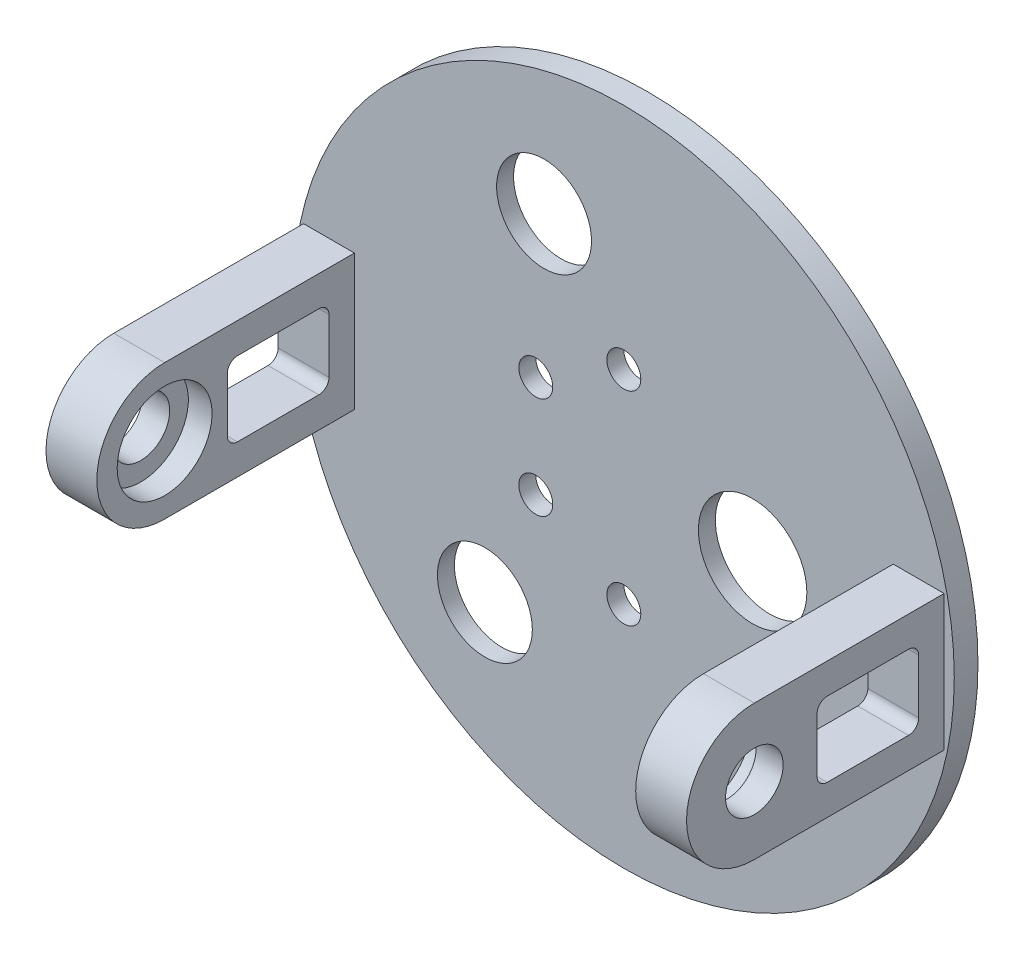
from build123d import *

# Parameters (mm, degrees)
SKETCH1_R           = 97.5
SKETCH1_R_2         = 16
BOSS_EXTRUDE1_DEPTH = 2.5
SKETCH2_R           = 5
CUT_EXTRUDE1_DEPTH  = 138.976447265
CIRPATTERN1_COUNT   = 4
CIRPATTERN1_ANGLE   = 180
SKETCH4_R           = 97.5
SKETCH4_R_2         = 94.5
BOSS_EXTRUDE2_DEPTH = 2
SKETCH5_R           = 8.5
BOSS_EXTRUDE3_DEPTH = 7.5
SKETCH6_R           = 14
CUT_EXTRUDE2_DEPTH  = 7
CUT_EXTRUDE3_REACH  = 231.2
CUT_EXTRUDE4_REACH  = 159.444
SKETCH8_R           = 14
SKETCH9_R           = 14
CUT_EXTRUDE5_DEPTH  = 158.44364071


with BuildPart() as part:
    # Sketch1 → Boss-Extrude1 (new, symmetric)
    with BuildSketch(Plane.XY):
        Circle(SKETCH1_R)
        with Locations((38, 0)):
            Circle(SKETCH1_R_2, mode=Mode.SUBTRACT)
    extrude(amount=BOSS_EXTRUDE1_DEPTH, both=True)

    # Sketch2 → Cut-Extrude1 (cut, through all)
    with BuildSketch(Plane.XY.offset(2.5)):
        with Locations((0, 30)):
            Circle(SKETCH2_R)
    cut_extrude1 = extrude(amount=-CUT_EXTRUDE1_DEPTH, mode=Mode.SUBTRACT)

    # CirPattern1: Cut-Extrude1 ×4 about axis
    cirpattern1_axis = Axis((0, 0, 2.5), (0, 0, 1))
    for i in range(1, CIRPATTERN1_COUNT):
        add(cut_extrude1.rotate(cirpattern1_axis, i * CIRPATTERN1_ANGLE / (CIRPATTERN1_COUNT - 1)), mode=Mode.SUBTRACT)

    # Sketch4 → Boss-Extrude2 (add)
    with BuildSketch(Plane(origin=(0, 0, -2.5), x_dir=(-1, 0, 0), z_dir=(0, 0, -1))):
        Circle(SKETCH4_R)
        Circle(SKETCH4_R_2, mode=Mode.SUBTRACT)
    extrude(amount=BOSS_EXTRUDE2_DEPTH)

    # Sketch5 → Boss-Extrude3 (add, symmetric)
    with BuildSketch(Plane(origin=(87, 0, 0), x_dir=(0, 0, -1), z_dir=(1, 0, 0))):
        with BuildLine():
            Line((-2.5, 20), (-58.5, 20))
            ThreePointArc((-58.5, 20), (-78.5, 0), (-58.5, -20))
            Line((-58.5, -20), (-2.5, -20))
            Line((-2.5, -20), (-2.5, 20))
        make_face()
        with Locations((-58.5, 0)):
            Circle(SKETCH5_R, mode=Mode.SUBTRACT)
    boss_extrude3 = extrude(amount=BOSS_EXTRUDE3_DEPTH, both=True)

    # Sketch6 → Cut-Extrude2 (cut)
    with BuildSketch(Plane.ZY.offset(-79.5)):
        with Locations((58.5, 0)):
            Circle(SKETCH6_R)
    cut_extrude2 = extrude(amount=-CUT_EXTRUDE2_DEPTH, mode=Mode.SUBTRACT)

    # Sketch7 → Cut-Extrude3 (cut, up to next)
    with BuildSketch(Plane(origin=(94.5, 0, 0), x_dir=(0, 0, -1), z_dir=(1, 0, 0)), mode=Mode.PRIVATE) as cut_extrude3_sk1:
        with BuildLine():
            Line((-13, 11), (-37, 11))
            ThreePointArc((-37, 11), (-39.121320344, 10.121320344), (-40, 8))
            Line((-40, 8), (-40, -8))
            ThreePointArc((-40, -8), (-39.121320344, -10.121320344), (-37, -11))
            Line((-37, -11), (-13, -11))
            ThreePointArc((-13, -11), (-10.878679656, -10.121320344), (-10, -8))
            Line((-10, -8), (-10, 8))
            ThreePointArc((-10, 8), (-10.878679656, 10.121320344), (-13, 11))
        make_face()
    cut_extrude3_tool1 = extrude(cut_extrude3_sk1.sketch, amount=-CUT_EXTRUDE3_REACH, mode=Mode.PRIVATE) & part.part
    cut_extrude3 = cut_extrude3_tool1.solids().sort_by_distance((94.5, 0, 25))[0]
    add(cut_extrude3, mode=Mode.SUBTRACT)

    # Mirror1: Boss-Extrude3, Cut-Extrude2, Cut-Extrude3 across plane
    add(boss_extrude3.mirror(Plane(origin=(0, 0, 0), x_dir=(0, 0, 1), z_dir=(1, 0, 0))))
    add(cut_extrude2.mirror(Plane(origin=(0, 0, 0), x_dir=(0, 0, 1), z_dir=(1, 0, 0))), mode=Mode.SUBTRACT)
    add(cut_extrude3.mirror(Plane(origin=(0, 0, 0), x_dir=(0, 0, 1), z_dir=(1, 0, 0))), mode=Mode.SUBTRACT)

    # Sketch8 → Cut-Extrude4 (cut, up to next)
    with BuildSketch(Plane.XY.offset(2.5), mode=Mode.PRIVATE) as cut_extrude4_sk1:
        with Locations((-41, -50)):
            Circle(SKETCH8_R)
    cut_extrude4_tool1 = extrude(cut_extrude4_sk1.sketch, amount=-CUT_EXTRUDE4_REACH, mode=Mode.PRIVATE) & part.part
    add(cut_extrude4_tool1.solids().sort_by_distance((-41, -50, 2.5))[0], mode=Mode.SUBTRACT)

    # Sketch9 → Cut-Extrude5 (cut, through all)
    with BuildSketch(Plane.XY.offset(2.5)):
        with Locations((-23.540161495, 58)):
            Circle(SKETCH9_R)
    extrude(amount=-CUT_EXTRUDE5_DEPTH, mode=Mode.SUBTRACT)


solid = part.part
